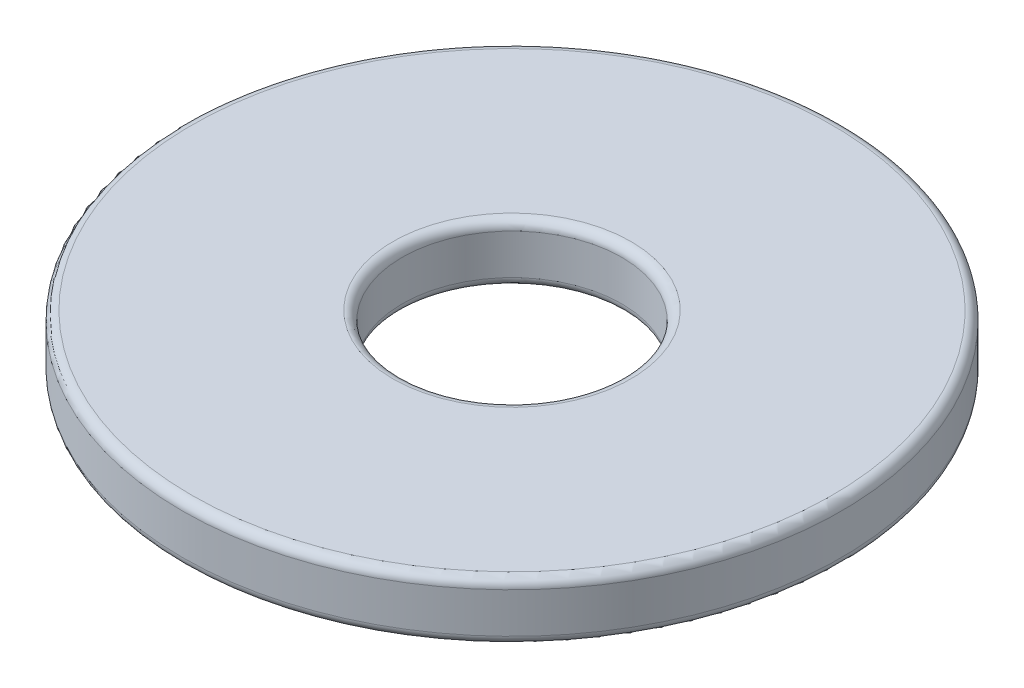
from build123d import *

# Parameters (mm, degrees)
SKETCH1_R           = 9
SKETCH1_R_2         = 3
BOSS_EXTRUDE1_DEPTH = 1.6
FILLET1_R           = 0.25


with BuildPart() as part:
    # Sketch1 → Boss-Extrude1 (new body)
    with BuildSketch(Plane(origin=(0, 0, 0), x_dir=(1, 0, 0), z_dir=(0, 1, 0))):
        with Locations(Location((0, 0, 0), (0, 0, 270))):
            Circle(SKETCH1_R)
        with Locations(Location((0, 0, 0), (0, 0, 270))):
            Circle(SKETCH1_R_2, mode=Mode.SUBTRACT)
    extrude(amount=BOSS_EXTRUDE1_DEPTH)

    # Fillet1
    fillet1_edges = [part.edges().sort_by_distance(p)[0] for p in [
        (0, 0, -9),
        (0, 1.6, -9),
        (0, 0, -3),
        (0, 1.6, -3),
    ]]
    fillet(fillet1_edges, radius=FILLET1_R)


solid = part.part
